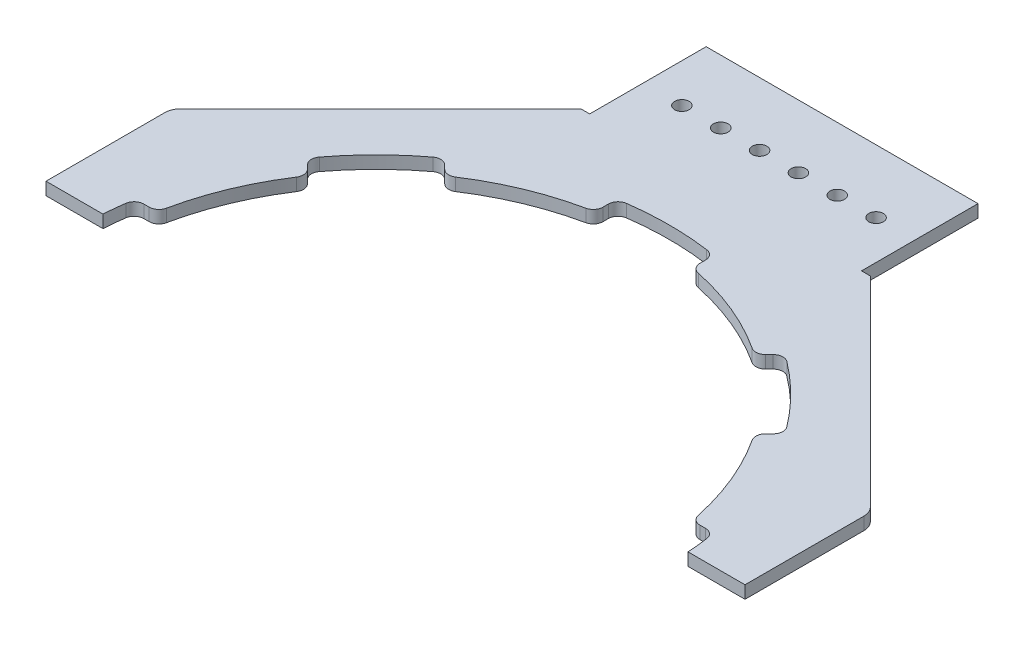
from build123d import *

# Parameters (mm, degrees)
BOSS_EXTRUDE1_DEPTH = 0.65
SKETCH2_R           = 0.375
CUT_EXTRUDE1_DEPTH  = 31.007040842
SKETCH3_R           = 0.75
BOSS_EXTRUDE2_DEPTH = 0.2
DOME1_FACE_RADIUS   = 0.75
DOME1_HEIGHT        = 0.5
FILLET1_R           = 0.4
SKETCH4_W           = 0.530330086
SKETCH4_H           = 0.530330086
CUT_EXTRUDE2_DEPTH  = 31.008165557
LPATTERN1_COUNT     = 6
LPATTERN1_PITCH     = 2


with BuildPart() as part:
    # Sketch1 → Boss-Extrude1 (new body)
    with BuildSketch(Plane(origin=(0, 0, 0), x_dir=(1, 0, 0), z_dir=(0, 1, 0))):
        with BuildLine():
            Line((14.186260957, 2.5), (14.462364956, 2.5))
            ThreePointArc((14.462364956, 2.5), (14.790810859, 2.376992424), (14.957651425, 2.068493152))
            ThreePointArc((14.957651425, 2.068493152), (15.021754437, 1.535217801), (15.066851033, 1.000000001))
            Line((15.066851033, 1.000000001), (18.000000002, 1.000000001))
            Line((18.000000002, 1.000000001), (18.000000002, 7.124473274))
            ThreePointArc((18.000000002, 7.124473274), (17.939103628, 7.430620021), (17.765685427, 7.6901587))
            Line((17.765685427, 7.6901587), (7.455844127, 18))
            Line((7.455844127, 18), (7, 18))
            Line((7, 18), (7, 24))
            Line((7, 24), (-7, 24))
            Line((-7, 24), (-7, 18))
            Line((-7, 18), (-7.455844127, 18))
            Line((-7.455844127, 18), (-17.765685427, 7.6901587))
            ThreePointArc((-17.765685427, 7.6901587), (-17.939103628, 7.430620021), (-18.000000002, 7.124473274))
            Line((-18.000000002, 7.124473274), (-18.000000002, 1.000000001))
            Line((-18.000000002, 1.000000001), (-15.066851033, 1.000000001))
            ThreePointArc((-15.066851033, 1.000000001), (-15.021754437, 1.535217801), (-14.957651425, 2.068493152))
            ThreePointArc((-14.957651425, 2.068493152), (-14.790810859, 2.376992424), (-14.462364956, 2.5))
            Line((-14.462364956, 2.5), (-14.186260957, 2.5))
            ThreePointArc((-14.186260957, 2.5), (-13.871399194, 2.611590333), (-13.697079547, 2.896551723))
            ThreePointArc((-13.697079547, 2.896551723), (-12.934313455, 5.357568053), (-11.733469195, 7.637126465))
            ThreePointArc((-11.733469195, 7.637126465), (-11.655233668, 7.961887201), (-11.798968275, 8.26343437))
            Line((-11.798968275, 8.26343437), (-11.994203285, 8.45866938))
            ThreePointArc((-11.994203285, 8.45866938), (-12.13947012, 8.777895196), (-12.039302288, 9.114011219))
            ThreePointArc((-12.039302288, 9.114011219), (-10.677312397, 10.677312397), (-9.114011219, 12.039302288))
            ThreePointArc((-9.114011219, 12.039302288), (-8.777895196, 12.13947012), (-8.45866938, 11.994203285))
            Line((-8.45866938, 11.994203285), (-8.26343437, 11.798968275))
            ThreePointArc((-8.26343437, 11.798968275), (-7.961887201, 11.655233668), (-7.637126465, 11.733469195))
            ThreePointArc((-7.637126465, 11.733469195), (-5.357568054, 12.934313455), (-2.896551723, 13.697079547))
            ThreePointArc((-2.896551723, 13.697079547), (-2.611590334, 13.871399194), (-2.500000001, 14.186260957))
            Line((-2.500000001, 14.186260957), (-2.500000001, 14.462364956))
            ThreePointArc((-2.500000001, 14.462364956), (-2.376992425, 14.790810859), (-2.068493153, 14.957651425))
            ThreePointArc((-2.068493153, 14.957651425), (0, 15.100000002), (2.068493153, 14.957651425))
            ThreePointArc((2.068493153, 14.957651425), (2.376992425, 14.790810859), (2.500000001, 14.462364956))
            Line((2.500000001, 14.462364956), (2.500000001, 14.186260957))
            ThreePointArc((2.500000001, 14.186260957), (2.611590334, 13.871399194), (2.896551723, 13.697079547))
            ThreePointArc((2.896551723, 13.697079547), (5.357568054, 12.934313455), (7.637126465, 11.733469195))
            ThreePointArc((7.637126465, 11.733469195), (7.961887201, 11.655233668), (8.26343437, 11.798968275))
            Line((8.26343437, 11.798968275), (8.45866938, 11.994203285))
            ThreePointArc((8.45866938, 11.994203285), (8.777895196, 12.13947012), (9.114011219, 12.039302288))
            ThreePointArc((9.114011219, 12.039302288), (10.677312397, 10.677312397), (12.039302288, 9.114011219))
            ThreePointArc((12.039302288, 9.114011219), (12.13947012, 8.777895196), (11.994203285, 8.45866938))
            Line((11.994203285, 8.45866938), (11.798968275, 8.26343437))
            ThreePointArc((11.798968275, 8.26343437), (11.655233668, 7.961887201), (11.733469195, 7.637126465))
            ThreePointArc((11.733469195, 7.637126465), (12.934313455, 5.357568053), (13.697079547, 2.896551723))
            ThreePointArc((13.697079547, 2.896551723), (13.871399194, 2.611590333), (14.186260957, 2.5))
        make_face()
    extrude(amount=-BOSS_EXTRUDE1_DEPTH)

    # Sketch2 → Cut-Extrude1 (cut, through all)
    with BuildSketch(Plane(origin=(0, 0, 0), x_dir=(-1, 0, 0), z_dir=(0, 1, 0))):
        with Locations(Location((-5, -20.75, 0), (0, 0, 270))):
            Circle(SKETCH2_R)
        with Locations(Location((3, -20.75, 0), (0, 0, 270))):
            Circle(SKETCH2_R)
        with Locations(Location((1, -20.75, 0), (0, 0, 270))):
            Circle(SKETCH2_R)
        with Locations(Location((-1, -20.75, 0), (0, 0, 270))):
            Circle(SKETCH2_R)
        with Locations(Location((-3, -20.75, 0), (0, 0, 270))):
            Circle(SKETCH2_R)
        with Locations(Location((5, -20.75, 0), (0, 0, 270))):
            Circle(SKETCH2_R)
    extrude(amount=-CUT_EXTRUDE1_DEPTH, mode=Mode.SUBTRACT)


with BuildPart() as body_2:
    # Sketch3 → Boss-Extrude2 (new body)
    with BuildSketch(Plane.XZ.offset(0.65)):
        with Locations(Location((5, -20.75, 0), (0, 0, 270))):
            Circle(SKETCH3_R)
    extrude(amount=BOSS_EXTRUDE2_DEPTH)

    # Dome1: a dome of height H over a round flat face of radius A is a cap of a sphere of radius (A * A + H * H) / (2 * H)
    dome1_r = (DOME1_FACE_RADIUS * DOME1_FACE_RADIUS + DOME1_HEIGHT * DOME1_HEIGHT) / (2 * DOME1_HEIGHT)
    dome1_base = Plane((5, -0.85, -20.75), z_dir=(0, -1, 0))
    with Locations(dome1_base.offset(DOME1_HEIGHT - dome1_r)):
        dome1_ball = Sphere(dome1_r, mode=Mode.PRIVATE)
    add(split(dome1_ball, bisect_by=dome1_base, keep=Keep.TOP, mode=Mode.PRIVATE))

    # Fillet1
    fillet1_edges = [body_2.edges().sort_by_distance(p)[0] for p in [
        (5, -0.85, -20),
    ]]
    fillet(fillet1_edges, radius=FILLET1_R)

    # Sketch4 → Cut-Extrude2 (cut, through all)
    with BuildSketch(Plane(origin=(0, -0.65, 0), x_dir=(1, 0, 0), z_dir=(0, 1, 0))):
        with Locations((5, 20.75)):
            Rectangle(SKETCH4_W, SKETCH4_H)
    extrude(amount=-CUT_EXTRUDE2_DEPTH, mode=Mode.SUBTRACT)


with BuildPart() as lpattern1_1:
    # LPattern1: pattern copy
    add(body_2.part.moved(Location(Vector(-1, 0, 0) * (1 * LPATTERN1_PITCH))))


with BuildPart() as lpattern1_2:
    # LPattern1: pattern copy
    add(body_2.part.moved(Location(Vector(-1, 0, 0) * (2 * LPATTERN1_PITCH))))


with BuildPart() as lpattern1_3:
    # LPattern1: pattern copy
    add(body_2.part.moved(Location(Vector(-1, 0, 0) * (3 * LPATTERN1_PITCH))))


with BuildPart() as lpattern1_4:
    # LPattern1: pattern copy
    add(body_2.part.moved(Location(Vector(-1, 0, 0) * (4 * LPATTERN1_PITCH))))


with BuildPart() as lpattern1_5:
    # LPattern1: pattern copy
    add(body_2.part.moved(Location(Vector(-1, 0, 0) * (5 * LPATTERN1_PITCH))))

    # Combine2: union LPattern1_4, LPattern1_3, LPattern1_2, LPattern1_1, body 2, part
    add(lpattern1_4.part)
    add(lpattern1_3.part)
    add(lpattern1_2.part)
    add(lpattern1_1.part)
    add(body_2.part)
    add(part.part)


solid = lpattern1_5.part
